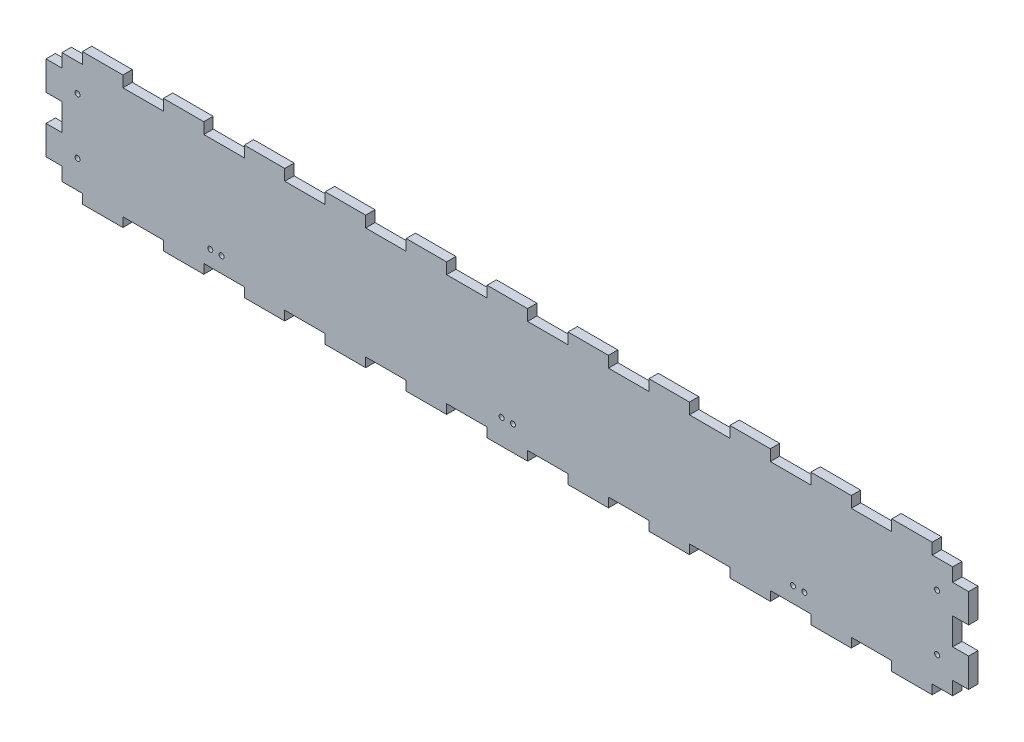
from build123d import *

# Parameters (mm, degrees)
SKETCH1_R           = 1.55
BOSS_EXTRUDE1_DEPTH = 5.8


with BuildPart() as part:
    # Sketch1 → Boss-Extrude1 (new body)
    with BuildSketch(Plane.XY):
        Polygon((-213.609090909, 31.65), (-213.609090909, 38.5), (-188.609090909, 38.5), (-188.609090909, 31.65), (-163.609090909, 31.65), (-163.609090909, 38.5), (-138.609090909, 38.5), (-138.609090909, 31.65), (-113.609090909, 31.65), (-113.609090909, 38.5), (-88.609090909, 38.5), (-88.609090909, 31.65), (-63.609090909, 31.65), (-63.609090909, 38.5), (-38.609090909, 38.5), (-38.609090909, 31.65), (-13.609090909, 31.65), (-13.609090909, 38.5), (11.390909091, 38.5), (11.390909091, 31.65), (36.390909091, 31.65), (36.390909091, 38.5), (61.390909091, 38.5), (61.390909091, 31.65), (86.390909091, 31.65), (86.390909091, 38.5), (111.390909091, 38.5), (111.390909091, 31.65), (136.390909091, 31.65), (136.390909091, 38.5), (161.390909091, 38.5), (161.390909091, 31.65), (186.390909091, 31.65), (186.390909091, 38.5), (211.390909091, 38.5), (211.390909091, 31.65), (236.390909091, 31.65), (236.390909091, 38.5), (261.390909091, 38.5), (261.390909091, 31.65), (274.040909091, 31.65), (274.040909091, 23.35), (283.890909091, 23.35), (283.890909091, 5.45), (274.040909091, 5.45), (274.040909091, -11.15), (283.890909091, -11.15), (283.890909091, -29.05), (274.040909091, -29.05), (274.040909091, -37.35), (261.390909091, -37.35), (261.390909091, -43.15), (236.390909091, -43.15), (236.390909091, -37.35), (211.390909091, -37.35), (211.390909091, -43.15), (186.390909091, -43.15), (186.390909091, -37.35), (161.390909091, -37.35), (161.390909091, -43.15), (136.390909091, -43.15), (136.390909091, -37.35), (111.390909091, -37.35), (111.390909091, -43.15), (86.390909091, -43.15), (86.390909091, -37.35), (61.390909091, -37.35), (61.390909091, -43.15), (36.390909091, -43.15), (36.390909091, -37.35), (11.390909091, -37.35), (11.390909091, -43.15), (-13.609090909, -43.15), (-13.609090909, -37.35), (-38.609090909, -37.35), (-38.609090909, -43.15), (-63.609090909, -43.15), (-63.609090909, -37.35), (-88.609090909, -37.35), (-88.609090909, -43.15), (-113.609090909, -43.15), (-113.609090909, -37.35), (-138.609090909, -37.35), (-138.609090909, -43.15), (-163.609090909, -43.15), (-163.609090909, -37.35), (-188.609090909, -37.35), (-188.609090909, -43.15), (-213.609090909, -43.15), (-213.609090909, -37.35), (-238.609090909, -37.35), (-238.609090909, -43.15), (-263.609090909, -43.15), (-263.609090909, -37.35), (-276.259090909, -37.35), (-276.259090909, -29.05), (-286.109090909, -29.05), (-286.109090909, -11.15), (-276.259090909, -11.15), (-276.259090909, 5.45), (-286.109090909, 5.45), (-286.109090909, 23.35), (-276.259090909, 23.35), (-276.259090909, 31.65), (-263.609090909, 31.65), (-263.609090909, 38.5), (-238.609090909, 38.5), (-238.609090909, 31.65), align=None)
        with Locations((-266.639090909, -20.1)):
            Circle(SKETCH1_R, mode=Mode.SUBTRACT)
        with Locations((-266.639090909, 14.4)):
            Circle(SKETCH1_R, mode=Mode.SUBTRACT)
        with Locations((264.420909091, 14.4)):
            Circle(SKETCH1_R, mode=Mode.SUBTRACT)
        with Locations((264.420909091, -20.1)):
            Circle(SKETCH1_R, mode=Mode.SUBTRACT)
        with Locations((-4.609090909, -27.73)):
            Circle(SKETCH1_R, mode=Mode.SUBTRACT)
        with Locations((2.390909091, -27.73)):
            Circle(SKETCH1_R, mode=Mode.SUBTRACT)
        with Locations((175.390909091, -27.73)):
            Circle(SKETCH1_R, mode=Mode.SUBTRACT)
        with Locations((182.390909091, -27.73)):
            Circle(SKETCH1_R, mode=Mode.SUBTRACT)
        with Locations((-184.609090909, -27.73)):
            Circle(SKETCH1_R, mode=Mode.SUBTRACT)
        with Locations((-177.609090909, -27.73)):
            Circle(SKETCH1_R, mode=Mode.SUBTRACT)
    extrude(amount=BOSS_EXTRUDE1_DEPTH)


solid = part.part
